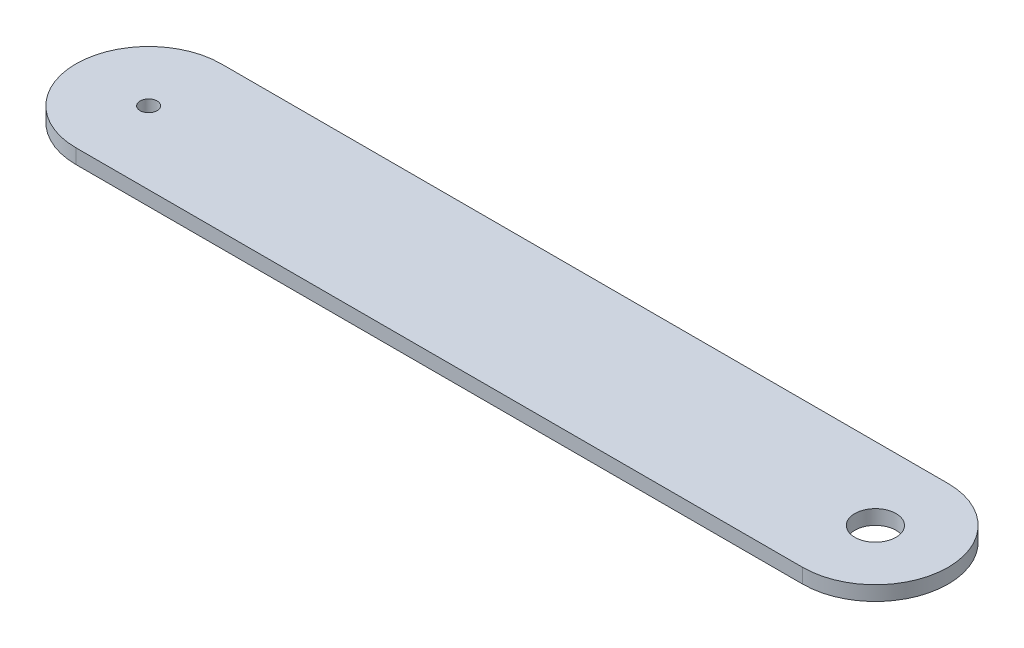
from build123d import *

# Parameters (mm, degrees)
RESSALTO_EXTRUS_O2_DEPTH = 3
ESBO_O4_R                = 1.75
ESBO_O4_R_2              = 4.25
CORTE_EXTRUS_O1_DEPTH    = 10


with BuildPart() as part:
    # Esboço3 → Ressalto-extrusão2 (new body)
    with BuildSketch(Plane(origin=(0, 0, 0), x_dir=(1, 0, 0), z_dir=(0, 1, 0))):
        with BuildLine():
            Line((-50, 15), (100, 15))
            ThreePointArc((100, 15), (115, 0), (100, -15))
            Line((100, -15), (-50, -15))
            ThreePointArc((-50, -15), (-65, 0), (-50, 15))
        make_face()
    extrude(amount=RESSALTO_EXTRUS_O2_DEPTH)

    # Esboço4 → Corte-extrusão1 (cut)
    with BuildSketch(Plane(origin=(0, 3, 0), x_dir=(1, 0, 0), z_dir=(0, 1, 0))):
        with Locations(Location((-50, 0, 0), (0, 0, 270))):
            Circle(ESBO_O4_R)
        with Locations(Location((100, 0, 0), (0, 0, 90))):
            Circle(ESBO_O4_R_2)
    extrude(amount=-CORTE_EXTRUS_O1_DEPTH, mode=Mode.SUBTRACT)


solid = part.part
